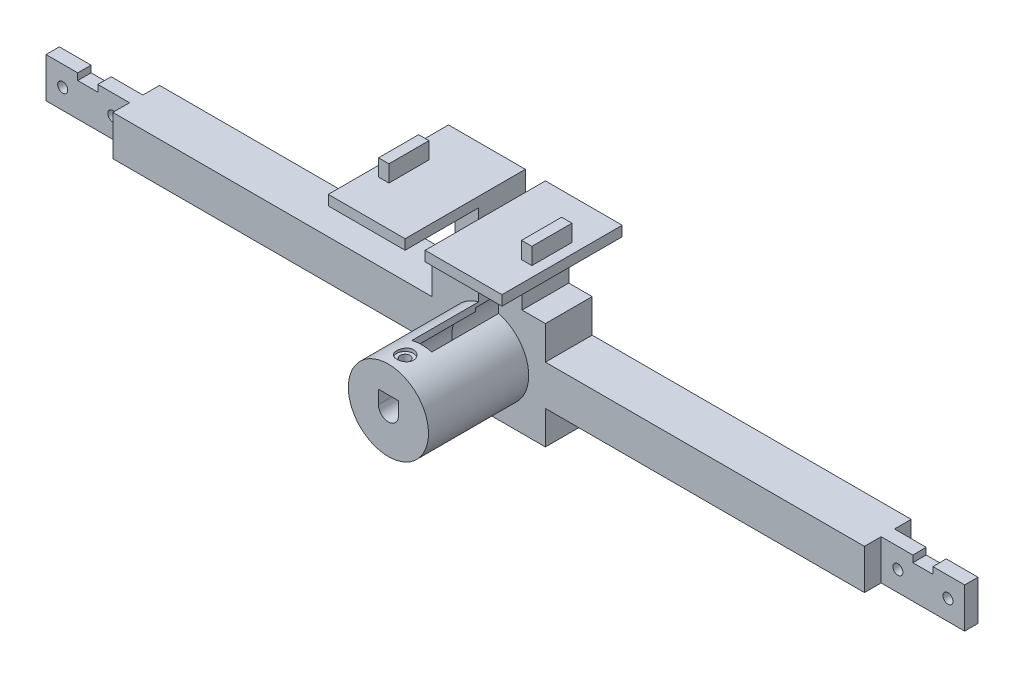
from build123d import *

# Parameters (mm, degrees)
BOSS_EXTRUDE1_DEPTH = 14
SKETCH2_R           = 12
BOSS_EXTRUDE2_DEPTH = 30
CUT_EXTRUDE2_DEPTH  = 34
BOSS_EXTRUDE3_START = 19
BOSS_EXTRUDE3_DEPTH = 19
CUT_EXTRUDE3_DEPTH  = 149.789280528
SKETCH10_R          = 1.5
CUT_EXTRUDE5_DEPTH  = 148.87241122
CUT_EXTRUDE6_DEPTH  = 1.5
CUT_EXTRUDE7_REACH  = 160.077
SKETCH12_R          = 1.5
SKETCH13_R          = 2.5
CUT_EXTRUDE8_DEPTH  = 1
CUT_EXTRUDE9_DEPTH  = 1
SKETCH15_W          = 25
SKETCH15_H          = 5
CUT_EXTRUDE11_DEPTH = 148.452534766
CUT_EXTRUDE12_START = -5.5
SKETCH17_R          = 2.5
CUT_EXTRUDE12_DEPTH = 143.055074494
SKETCH18_W          = 23
SKETCH18_H          = 36
BOSS_EXTRUDE7_DEPTH = 3
SKETCH19_W          = 3.1
SKETCH19_H          = 12
BOSS_EXTRUDE8_DEPTH = 5
SKETCH21_R          = 1.5
SKETCH21_W          = 6
SKETCH21_H          = 2
CUT_EXTRUDE13_DEPTH = 149.550496489


with BuildPart() as part:
    # Sketch1 → Boss-Extrude1 (new body)
    with BuildSketch(Plane.XY):
        Polygon((10, 16), (17, 16), (17, 6), (137.5, 6), (137.5, -6), (17, -6), (17, -16), (-17, -16), (-17, -6), (-137.5, -6), (-137.5, 6), (-17, 6), (-17, 16), (-10, 16), (-10, 36), (10, 36), align=None)
    extrude(amount=BOSS_EXTRUDE1_DEPTH)

    # Sketch2 → Boss-Extrude2 (add)
    with BuildSketch(Plane.XY.offset(14)):
        Circle(SKETCH2_R)
    extrude(amount=BOSS_EXTRUDE2_DEPTH)

    # Sketch5 → Cut-Extrude2 (cut)
    with BuildSketch(Plane(origin=(0, 0, 0), x_dir=(-1, 0, 0), z_dir=(0, 0, -1))):
        with BuildLine():
            Line((-3, 36), (-3, 10.583005244))
            ThreePointArc((-3, 10.583005244), (0, -11), (3, 10.583005244))
            Line((3, 10.583005244), (3, 36))
            Line((3, 36), (-3, 36))
        make_face()
    extrude(amount=-CUT_EXTRUDE2_DEPTH, mode=Mode.SUBTRACT)

    # Sketch7 → Boss-Extrude3 (add)
    with BuildSketch(Plane(origin=(0, 0, 34), x_dir=(-1, 0, 0), z_dir=(0, 0, -1)).offset(BOSS_EXTRUDE3_START)):
        with BuildLine():
            Line((-3, 10.583005244), (-3, 9.539392014))
            ThreePointArc((-3, 9.539392014), (0, -10), (3, 9.539392014))
            Line((3, 9.539392014), (3, 10.583005244))
            ThreePointArc((3, 10.583005244), (0, -11), (-3, 10.583005244))
        make_face()
    extrude(amount=-BOSS_EXTRUDE3_DEPTH)

    # Sketch6 → Cut-Extrude3 (cut, through all)
    with BuildSketch(Plane.XY.offset(44)):
        with BuildLine():
            Line((-3, 0), (-3, 4))
            Line((-3, 4), (3, 4))
            Line((3, 4), (3, 0))
            ThreePointArc((3, 0), (0, -3), (-3, 0))
        make_face()
    extrude(amount=-CUT_EXTRUDE3_DEPTH, mode=Mode.SUBTRACT)

    # Sketch10 → Cut-Extrude5 (cut, through all)
    with BuildSketch(Plane(origin=(0, 4, 0), x_dir=(-1, 0, 0), z_dir=(0, -1, 0))):
        with Locations(Location((0, -39, 0), (0, 0, 90))):
            Circle(SKETCH10_R)
    extrude(amount=-CUT_EXTRUDE5_DEPTH, mode=Mode.SUBTRACT)

    # Sketch11 → Cut-Extrude6 (cut)
    with BuildSketch(Plane.XZ.offset(-4)):
        Polygon((2, 37.845299462), (2, 40.154700538), (0, 41.309401077), (-2, 40.154700538), (-2, 37.845299462), (0, 36.690598923), align=None)
    extrude(amount=-CUT_EXTRUDE6_DEPTH, mode=Mode.SUBTRACT)

    # Cut-Extrude7: up to this face of the body (flat: up to its plane)
    cut_extrude7_end = Plane(part.part.faces().sort_by_distance((-10, 26, 7))[0])
    # Sketch12 → Cut-Extrude7 (cut, up to the picked face)
    with BuildSketch(Plane(origin=(10, 0, 0), x_dir=(0, 0, -1), z_dir=(1, 0, 0)), mode=Mode.PRIVATE) as cut_extrude7_sk1:
        with Locations(Location((-7, 30.5, 0), (0, 0, 90))):
            Circle(SKETCH12_R)
    cut_extrude7_tool1 = split(extrude(cut_extrude7_sk1.sketch, amount=-CUT_EXTRUDE7_REACH, mode=Mode.PRIVATE), bisect_by=cut_extrude7_end, keep=Keep.BOTH, mode=Mode.PRIVATE)
    add(cut_extrude7_tool1.solids().sort_by(Axis((10, 30.5, 7), (-1, 0, 0)))[0], mode=Mode.SUBTRACT)

    # Sketch13 → Cut-Extrude8 (cut)
    with BuildSketch(Plane(origin=(10, 0, 0), x_dir=(0, 0, -1), z_dir=(1, 0, 0))):
        with Locations(Location((-7, 30.5, 0), (0, 0, 90))):
            Circle(SKETCH13_R)
    extrude(amount=-CUT_EXTRUDE8_DEPTH, mode=Mode.SUBTRACT)

    # Sketch14 → Cut-Extrude9 (cut)
    with BuildSketch(Plane.ZY.offset(10)):
        Polygon((4.690598923, 30.5), (5.845299462, 28.5), (8.154700538, 28.5), (9.309401077, 30.5), (8.154700538, 32.5), (5.845299462, 32.5), align=None)
    extrude(amount=-CUT_EXTRUDE9_DEPTH, mode=Mode.SUBTRACT)

    # Sketch15 → Cut-Extrude11 (cut, through all)
    with BuildSketch(Plane(origin=(0, 6, 0), x_dir=(1, 0, 0), z_dir=(0, 1, 0))):
        with Locations((-125, -11.5)):
            Rectangle(SKETCH15_W, SKETCH15_H)
        with Locations((-125, -2.5)):
            Rectangle(SKETCH15_W, SKETCH15_H)
    cut_extrude11 = extrude(amount=-CUT_EXTRUDE11_DEPTH, mode=Mode.SUBTRACT)

    # Mirror2: Cut-Extrude11 across plane
    add(cut_extrude11.mirror(Plane(origin=(0, 0, 0), x_dir=(0, 0, 1), z_dir=(1, 0, 0))), mode=Mode.SUBTRACT)

    # Sketch17 → Cut-Extrude12 (cut, through all)
    with BuildSketch(Plane.XZ.offset(-5.5).offset(CUT_EXTRUDE12_START)):
        with Locations(Location((0, 39, 0), (0, 0, 270))):
            Circle(SKETCH17_R)
    extrude(amount=-CUT_EXTRUDE12_DEPTH, mode=Mode.SUBTRACT)

    # Sketch18 → Boss-Extrude7 (add)
    with BuildSketch(Plane(origin=(0, 36, 0), x_dir=(1, 0, 0), z_dir=(0, 1, 0))):
        with Locations((-14.5, -18)):
            Rectangle(SKETCH18_W, SKETCH18_H)
        with Locations((14.5, -18)):
            Rectangle(SKETCH18_W, SKETCH18_H)
    extrude(amount=BOSS_EXTRUDE7_DEPTH)

    # Sketch19 → Boss-Extrude8 (add)
    with BuildSketch(Plane(origin=(0, 39, 0), x_dir=(1, 0, 0), z_dir=(0, 1, 0))):
        with Locations((-21.4, -18)):
            Rectangle(SKETCH19_W, SKETCH19_H)
        with Locations((21.4, -18)):
            Rectangle(SKETCH19_W, SKETCH19_H)
    extrude(amount=BOSS_EXTRUDE8_DEPTH)

    # Sketch21 → Cut-Extrude13 (cut, through all)
    with BuildSketch(Plane.XY.offset(9)):
        with Locations((-132.5, 0)):
            Circle(SKETCH21_R)
        with Locations((-117.5, 0)):
            Circle(SKETCH21_R)
        with Locations((-125, 5)):
            Rectangle(SKETCH21_W, SKETCH21_H)
    cut_extrude13 = extrude(amount=-CUT_EXTRUDE13_DEPTH, mode=Mode.SUBTRACT)

    # Mirror3: Cut-Extrude13 across plane
    add(cut_extrude13.mirror(Plane(origin=(0, 0, 0), x_dir=(0, 0, 1), z_dir=(1, 0, 0))), mode=Mode.SUBTRACT)


solid = part.part
